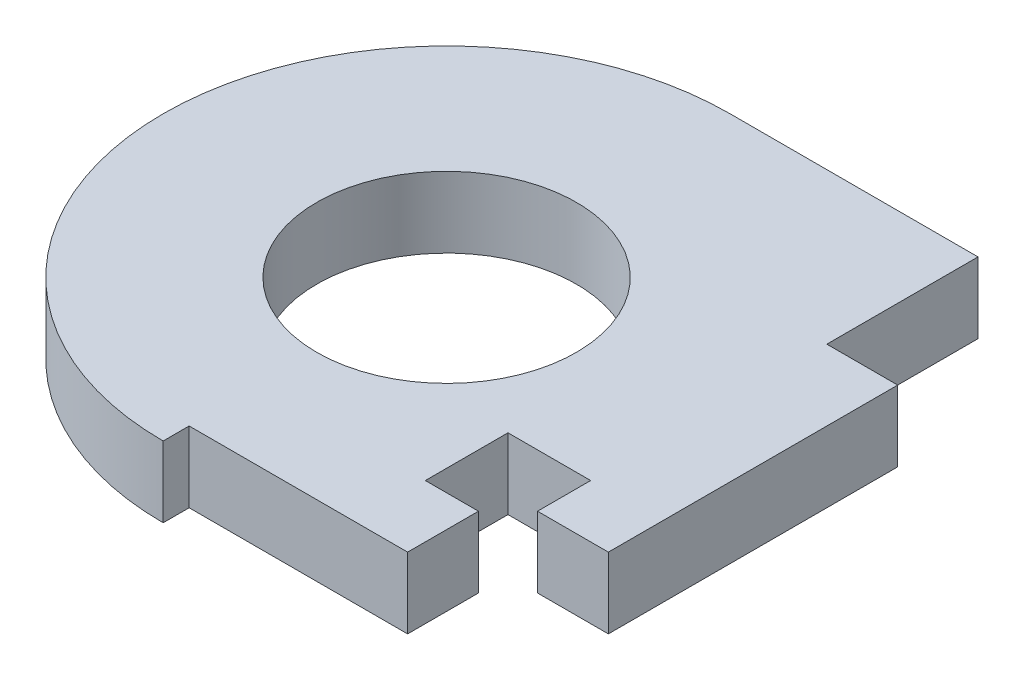
from build123d import *

# Parameters (mm, degrees)
SKETCH1_R           = 11
BOSS_EXTRUDE1_DEPTH = 6


with BuildPart() as part:
    # Sketch1 → Boss-Extrude1 (new body)
    with BuildSketch(Plane(origin=(0, 0, 0), x_dir=(1, 0, 0), z_dir=(0, 1, 0))):
        with BuildLine():
            Line((0, 0), (0, 7))
            Line((0, 7), (7, 7))
            Line((7, 7), (7, 2.5))
            Line((7, 2.5), (13, 2.5))
            Line((13, 2.5), (13, 27))
            Line((13, 27), (7, 27))
            Line((7, 27), (7, 39.8))
            Line((7, 39.8), (-14, 39.8))
            ThreePointArc((-14, 39.8), (-38, 15.8), (-14, -8.2))
            Line((-14, -8.2), (-14, -6))
            Line((-14, -6), (4.5, -6))
            Line((4.5, -6), (4.5, 0))
            Line((4.5, 0), (0, 0))
        make_face()
        with Locations(Location((-14, 15.8, 0), (0, 0, 270))):
            Circle(SKETCH1_R, mode=Mode.SUBTRACT)
    extrude(amount=BOSS_EXTRUDE1_DEPTH)


solid = part.part
